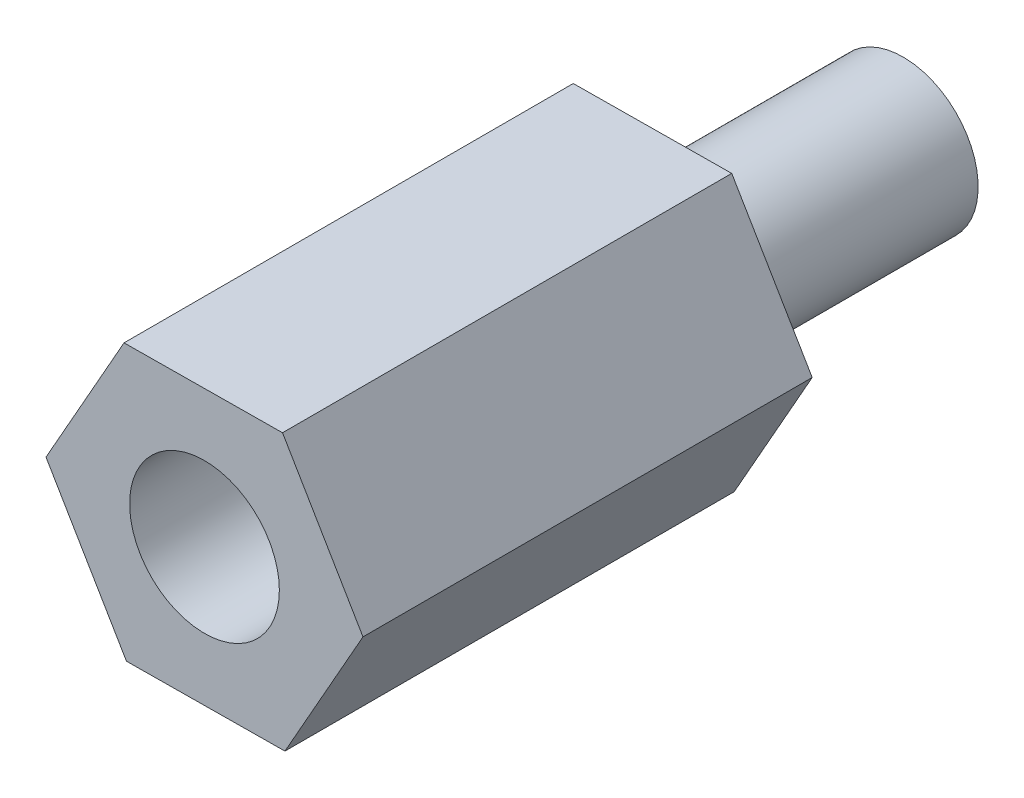
from build123d import *

# Parameters (mm, degrees)
SKETCH_1_R      = 1.5
EXTRUDE_1_DEPTH = 9
SKETCH_2_R      = 1.5
EXTRUDE_2_DEPTH = 5


with BuildPart() as part:
    # 草图1 → 凸台-拉伸1 (new body)
    with BuildSketch(Plane.XY):
        Polygon((1.61185848, -2.735917684), (3.175303457, 0.027951549), (1.563444977, 2.763869233), (-1.61185848, 2.735917684), (-3.175303457, -0.027951549), (-1.563444977, -2.763869233), align=None)
        Circle(SKETCH_1_R, mode=Mode.SUBTRACT)
    extrude(amount=EXTRUDE_1_DEPTH)


with BuildPart() as body_2:
    # 草图2 → 凸台-拉伸2 (new body)
    with BuildSketch(Plane(origin=(0, 0, 0), x_dir=(-1, 0, 0), z_dir=(0, 0, -1))):
        Circle(SKETCH_2_R)
    extrude(amount=EXTRUDE_2_DEPTH)


solid = Compound([part.part, body_2.part])
